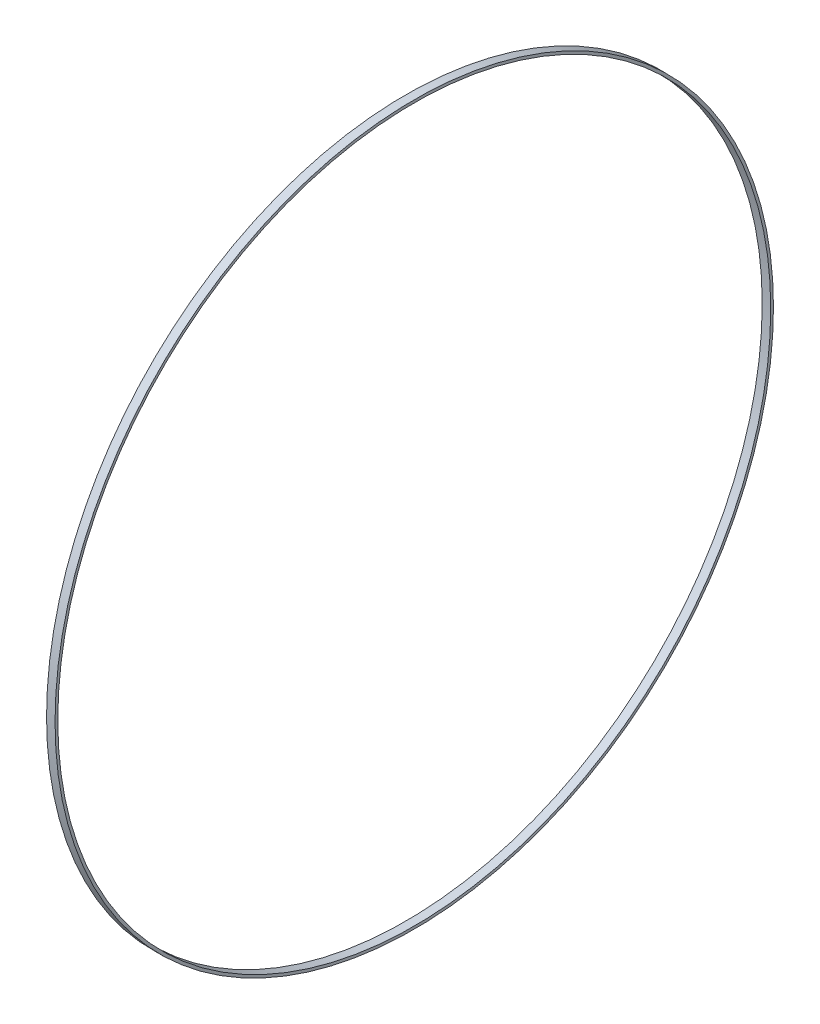
from build123d import *

# Parameters (mm, degrees)
SKETCH1_R           = 1055
SKETCH1_R_2         = 1047
BOSS_EXTRUDE1_DEPTH = 25


with BuildPart() as part:
    # Sketch1 → Boss-Extrude1 (new body)
    with BuildSketch(Plane(origin=(0, 0, 0), x_dir=(0, 0, -1), z_dir=(1, 0, 0))):
        Circle(SKETCH1_R)
        Circle(SKETCH1_R_2, mode=Mode.SUBTRACT)
    extrude(amount=BOSS_EXTRUDE1_DEPTH)


solid = part.part
